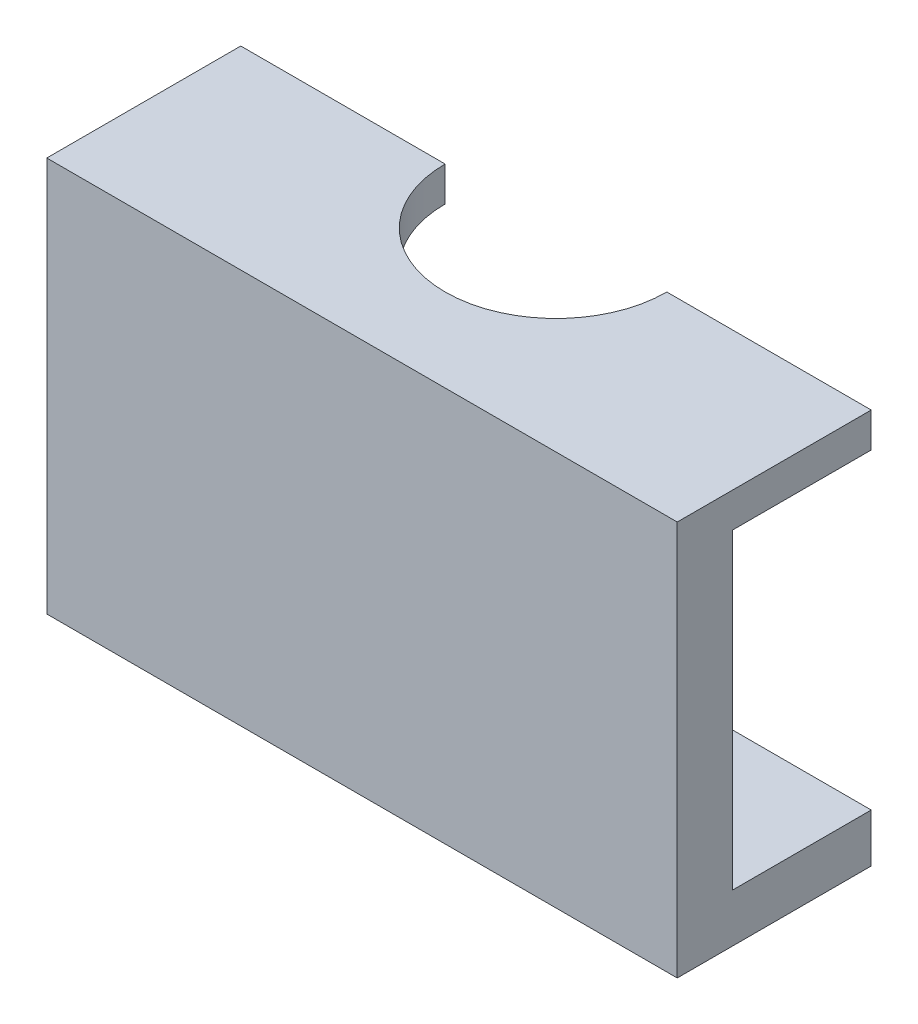
from build123d import *

# Parameters (mm, degrees)
SKETCH1_W           = 45.5
SKETCH1_H           = 28.5
BOSS_EXTRUDE1_DEPTH = 14
SKETCH2_R           = 8
CUT_EXTRUDE1_DEPTH  = 30
SKETCH3_R           = 11.1
CUT_EXTRUDE2_DEPTH  = 26
SKETCH4_W           = 9.997259543
SKETCH4_H           = 22.5
CUT_EXTRUDE3_DEPTH  = 56.484231994


with BuildPart() as part:
    # Sketch1 → Boss-Extrude1 (new body)
    with BuildSketch(Plane.XY):
        with Locations((22.75, 14.25)):
            Rectangle(SKETCH1_W, SKETCH1_H)
    extrude(amount=BOSS_EXTRUDE1_DEPTH)

    # Sketch2 → Cut-Extrude1 (cut)
    with BuildSketch(Plane(origin=(0, 28.5, 0), x_dir=(1, 0, 0), z_dir=(0, 1, 0))):
        with Locations((22.75, 0)):
            Circle(SKETCH2_R)
    extrude(amount=-CUT_EXTRUDE1_DEPTH, mode=Mode.SUBTRACT)

    # Sketch3 → Cut-Extrude2 (cut)
    with BuildSketch(Plane.XZ):
        with Locations((22.75, 0)):
            Circle(SKETCH3_R)
    extrude(amount=-CUT_EXTRUDE2_DEPTH, mode=Mode.SUBTRACT)

    # Sketch4 → Cut-Extrude3 (cut, through all)
    with BuildSketch(Plane(origin=(45.5, 0, 0), x_dir=(0, 0, -1), z_dir=(1, 0, 0))):
        with Locations((-4.998629772, 14.75)):
            Rectangle(SKETCH4_W, SKETCH4_H)
    extrude(amount=-CUT_EXTRUDE3_DEPTH, mode=Mode.SUBTRACT)


solid = part.part
